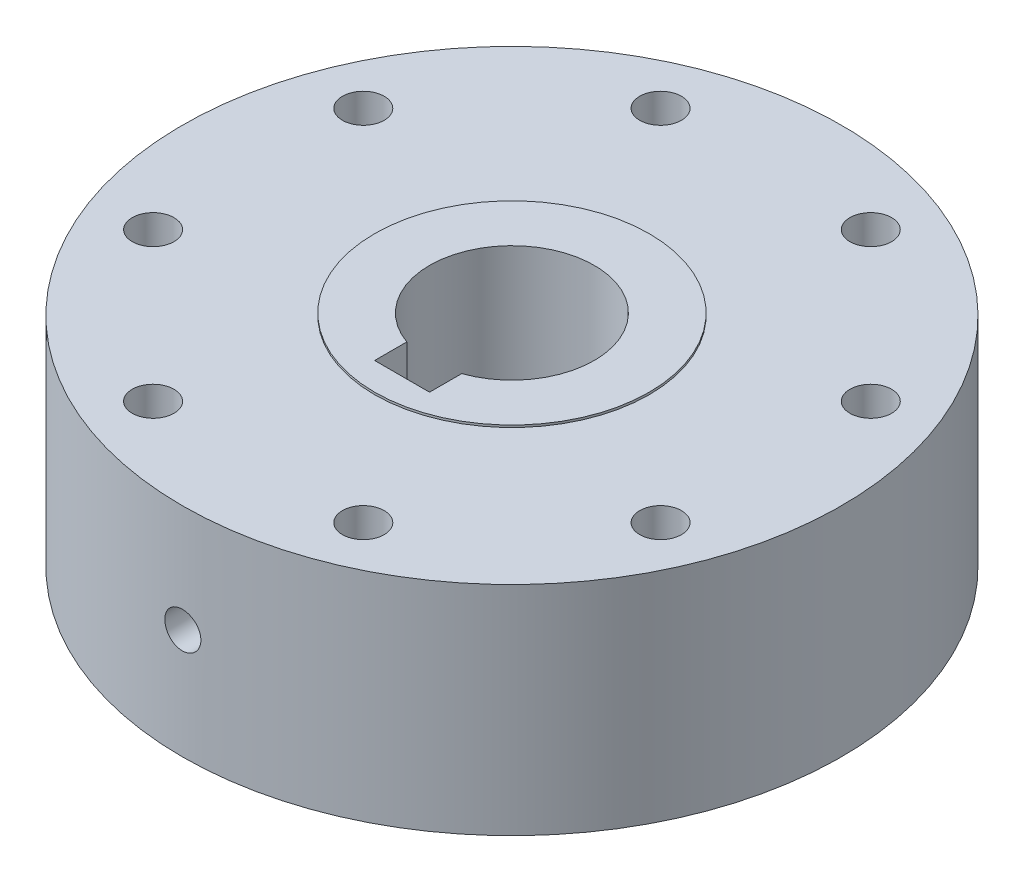
from build123d import *

# Parameters (mm, degrees)
SKETCH1_R              = 38.1
SKETCH1_R_2            = 9.525
BOSS_EXTRUDE1_DEPTH    = 25.4
F_10_32_TAPPED_HOLE1_D = 4.826
CIRPATTERN1_COUNT      = 8
SKETCH4_W              = 6.35
SKETCH4_H              = 6.35
CUT_EXTRUDE1_DEPTH     = 60.56828015
SKETCH5_W              = 2.0828
SKETCH5_H              = 25.4
SKETCH7_OUTSIDE_W      = 100.344
SKETCH7_OUTSIDE_H      = 100.344
SKETCH7_OUTSIDE_R      = 15.875
CUT_EXTRUDE2_DEPTH     = 0.254


with BuildPart() as part:
    # Sketch1 → Boss-Extrude1 (new body)
    with BuildSketch(Plane(origin=(0, 0, 0), x_dir=(1, 0, 0), z_dir=(0, 1, 0))):
        with Locations(Location((0, 0, 0), (0, 0, 270))):
            Circle(SKETCH1_R)
        with Locations(Location((0, 0, 0), (0, 0, 270))):
            Circle(SKETCH1_R_2, mode=Mode.SUBTRACT)
    extrude(amount=BOSS_EXTRUDE1_DEPTH)

    # #10-32 Tapped Hole1 (through all)
    with Locations(Plane(origin=(0, 25.4, 0), x_dir=(-1, 0, 0), z_dir=(0, 1, 0))):
        with Locations((29.333175157, -12.150198978)):
            f_10_32_tapped_hole1 = Hole(F_10_32_TAPPED_HOLE1_D / 2)

    # CirPattern1: #10-32 Tapped Hole1 ×8 about axis
    cirpattern1_axis = Axis((0, 0, 0), (0, 1, 0))
    for i in range(1, CIRPATTERN1_COUNT):
        add(f_10_32_tapped_hole1.rotate(cirpattern1_axis, i * 360 / CIRPATTERN1_COUNT), mode=Mode.SUBTRACT)

    # Sketch4 → Cut-Extrude1 (cut, through all)
    with BuildSketch(Plane(origin=(0, 25.4, 0), x_dir=(1, 0, 0), z_dir=(0, 1, 0))):
        with Locations((0, -9.525)):
            Rectangle(SKETCH4_W, SKETCH4_H)
    extrude(amount=-CUT_EXTRUDE1_DEPTH, mode=Mode.SUBTRACT)

    # Sketch5 → #8-32 Tapped Hole1 (revolve, cut)
    with BuildSketch(Plane(origin=(0, 12.7, 12.7), x_dir=(0, 1, 0), z_dir=(1, 0, 0))):
        with Locations((1.0414, 12.7)):
            Rectangle(SKETCH5_W, SKETCH5_H)
    revolve(axis=Axis((0, 12.7, 6.35), (0, 0, 1)), mode=Mode.SUBTRACT)

    # Sketch7 outside → Cut-Extrude2 (cut)
    with BuildSketch(Plane(origin=(0, 25.4, 0), x_dir=(1, 0, 0), z_dir=(0, 1, 0))):
        Rectangle(SKETCH7_OUTSIDE_W, SKETCH7_OUTSIDE_H)
        with Locations(Location((0, 0, 0), (0, 0, 270))):
            Circle(SKETCH7_OUTSIDE_R, mode=Mode.SUBTRACT)
    extrude(amount=-CUT_EXTRUDE2_DEPTH, mode=Mode.SUBTRACT)


solid = part.part
